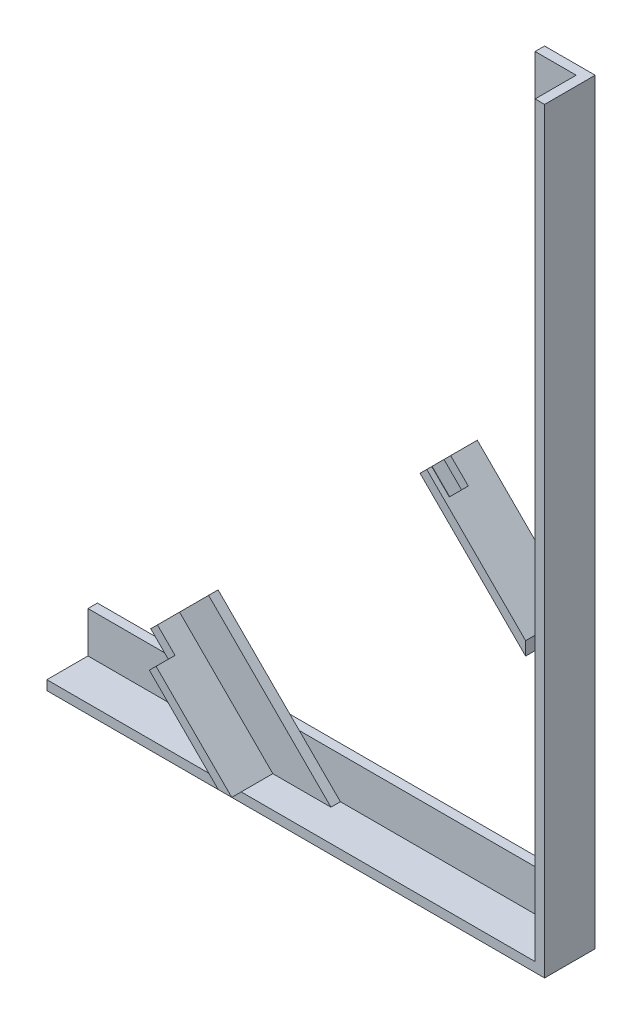
from build123d import *

# Parameters (mm, degrees)
SALIENTE_EXTRUIR1_DEPTH = 50.8
SALIENTE_EXTRUIR2_DEPTH = 9.525
SALIENTE_EXTRUIR3_DEPTH = 50.8
SALIENTE_EXTRUIR4_DEPTH = 9.525
CROQUIS5_W              = 19.05
CROQUIS5_H              = 9.525
CORTAR_EXTRUIR1_DEPTH   = 25


with BuildPart() as part:
    # Croquis1 → Saliente-Extruir1 (new body)
    with BuildSketch(Plane.XY):
        Polygon((0, 0), (0, 760), (-9.525, 760), (-9.525, 9.525), (-500, 9.525), (-500, 0), align=None)
    extrude(amount=SALIENTE_EXTRUIR1_DEPTH)

    # Croquis2 → Saliente-Extruir2 (add)
    with BuildSketch(Plane(origin=(0, 0, 0), x_dir=(-1, 0, 0), z_dir=(0, 0, -1))):
        Polygon((0, 760), (0, 0), (500, 0), (500, 50.8), (50.8, 50.8), (50.8, 760), align=None)
    extrude(amount=-SALIENTE_EXTRUIR2_DEPTH)

    # Croquis3 → Saliente-Extruir3 (add)
    with BuildSketch(Plane.XY.offset(9.525)):
        Polygon((-9.525, 280), (-115.591017178, 386.066017178), (-108.855825087, 392.801209269), (-9.525, 293.470384182), align=None)
        Polygon((-304.735424949, 9.525), (-318.205809131, 9.525), (-405.168921743, 96.488112613), (-398.433729653, 103.223304703), align=None)
    extrude(amount=SALIENTE_EXTRUIR3_DEPTH)

    # Croquis4 → Saliente-Extruir4 (add)
    with BuildSketch(Plane.XY.offset(9.525)):
        Polygon((-9.525, 280), (-115.591017178, 386.066017178), (-144.776849571, 356.880184785), (-9.525, 221.628335213), align=None)
        Polygon((-398.433729653, 103.223304703), (-304.735424949, 9.525), (-246.363760162, 9.525), (-369.247897259, 132.409137097), align=None)
    extrude(amount=SALIENTE_EXTRUIR4_DEPTH)

    # Croquis5 → Cortar-Extruir1 (cut)
    with BuildSketch(Plane(origin=(-250.828517178, 250.828517178, 0), x_dir=(0, 0, 1), z_dir=(-0.7071067811865419, 0.7071067811865532, 0))):
        with Locations((45.8, 196.017206641)):
            Rectangle(CROQUIS5_W, CROQUIS5_H)
        with Locations((50.8, -213.507793359)):
            Rectangle(CROQUIS5_W, CROQUIS5_H)
    extrude(amount=-CORTAR_EXTRUIR1_DEPTH, mode=Mode.SUBTRACT)


solid = part.part
